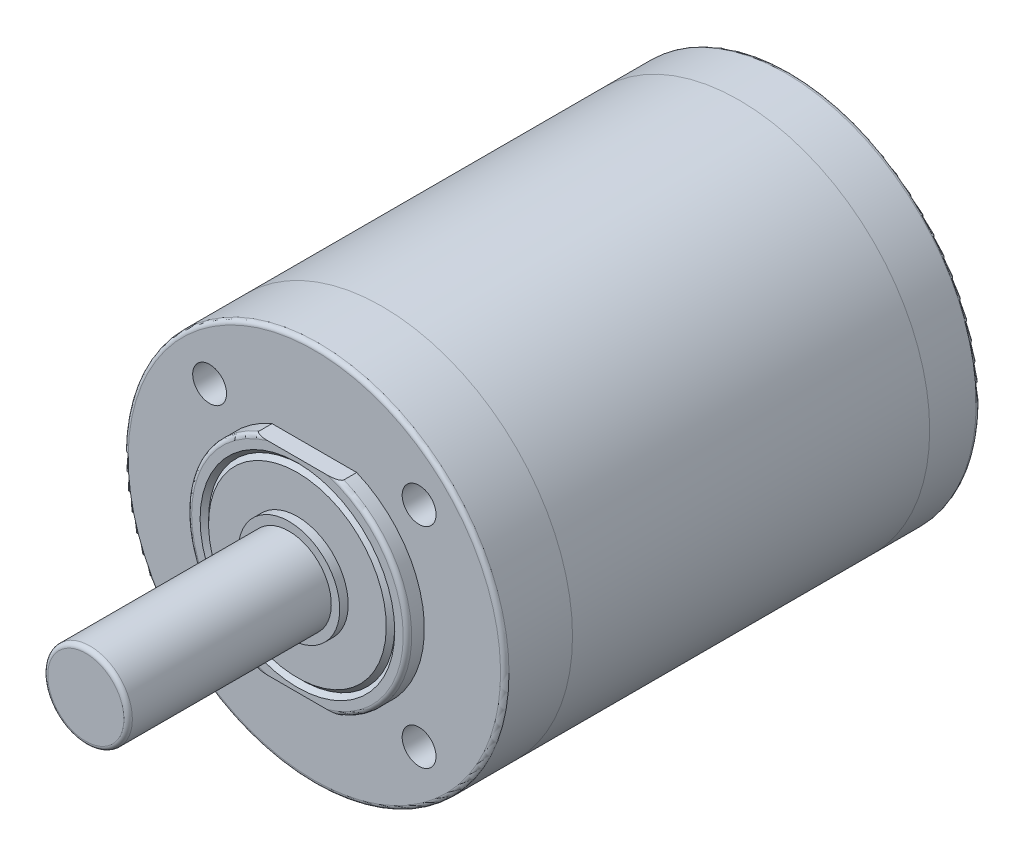
from build123d import *

# Parameters (mm, degrees)
FILLET1_R          = 0.5
CUT_EXTRUDE1_DEPTH = 2
SKETCH4_R          = 2
CUT_EXTRUDE2_DEPTH = 8


with BuildPart() as part:
    # Sketch1 → Revolve1 (revolve)
    with BuildSketch(Plane(origin=(0, 0, 0), x_dir=(0, 0, -1), z_dir=(1, 0, 0))):
        Polygon((0, 0), (0, 22.5), (-56.2, 22.5), (-56.2, 13), (-58.2, 13), (-58.2, 11.5), (-57.7, 11), (-58.2, 10.5), (-58.2, 6), (-59.2, 6), (-59.2, 5), (-83.2, 5), (-83.2, 0), align=None)
    revolve(axis=Axis((0, 0, 0), (0, 0, 1)))

    # Fillet1
    fillet1_edges = [part.edges().sort_by_distance(p)[0] for p in [
        (0, -5, 83.2),
        (0, -13, 58.2),
        (0, -22.5, 56.2),
        (0, -22.5, 0),
    ]]
    fillet(fillet1_edges, radius=FILLET1_R)

    # Sketch3 → Cut-Extrude1 (cut)
    with BuildSketch(Plane.XY.offset(58.2)):
        with BuildLine():
            Line((-5, 12), (5, 12))
            ThreePointArc((5, 12), (0, 13), (-5, 12))
        make_face()
        with BuildLine():
            Line((-5, -12), (5, -12))
            ThreePointArc((5, -12), (0, -13), (-5, -12))
        make_face()
    extrude(amount=-CUT_EXTRUDE1_DEPTH, mode=Mode.SUBTRACT)

    # Sketch4 → Cut-Extrude2 (cut)
    with BuildSketch(Plane.XY.offset(56.2)):
        with Locations((-12.374368671, 12.374368671)):
            Circle(SKETCH4_R)
        with Locations((12.374368671, 12.374368671)):
            Circle(SKETCH4_R)
        with Locations((12.374368671, -12.374368671)):
            Circle(SKETCH4_R)
        with Locations((-12.374368671, -12.374368671)):
            Circle(SKETCH4_R)
    extrude(amount=-CUT_EXTRUDE2_DEPTH, mode=Mode.SUBTRACT)


solid = part.part
